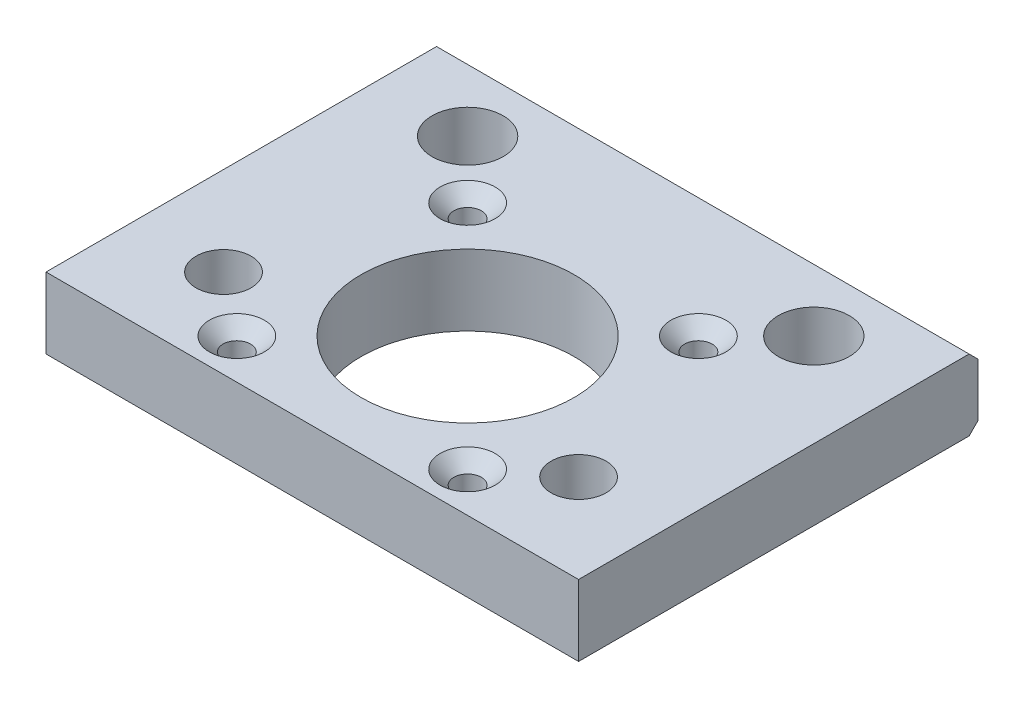
from build123d import *

# Parameters (mm, degrees)
SKETCH_1_W                  = 60
SKETCH_1_H                  = 45
SKETCH_1_R                  = 2.5
SKETCH_1_R_2                = 12
EXTRUDE_1_DEPTH             = 8
CHAMFER_1_SIZE              = 1
SKETCH_2_R                  = 4
CUT_EXTRUDE_1_DEPTH         = 6
SKETCH_3_R                  = 1.25
CUT_EXTRUDE_2_DEPTH         = 39.34383914
HOLE_WIZARD_2_D             = 6.2
HOLE_WIZARD_2_CSINK_D       = 13.2
HOLE_WIZARD_2_CSINK_ANGLE   = 90
HOLE_WIZARD_2_2_D           = 3.1
HOLE_WIZARD_2_2_CSINK_D     = 6.2
HOLE_WIZARD_2_2_CSINK_ANGLE = 90


with BuildPart() as part:
    # 草图1 → 凸台-拉伸1 (new body)
    with BuildSketch(Plane(origin=(0, 0, 0), x_dir=(1, 0, 0), z_dir=(0, 1, 0))):
        Rectangle(SKETCH_1_W, SKETCH_1_H)
        with Locations(Location((-20, -12.5, 0), (0, 0, 270))):
            Circle(SKETCH_1_R, mode=Mode.SUBTRACT)
        with Locations(Location((20, -12.5, 0), (0, 0, 90))):
            Circle(SKETCH_1_R, mode=Mode.SUBTRACT)
        with Locations(Location((0, -5, 0), (0, 0, 270))):
            Circle(SKETCH_1_R_2, mode=Mode.SUBTRACT)
    extrude(amount=EXTRUDE_1_DEPTH)

    # 倒角1
    chamfer_1_edges = [part.edges().sort_by_distance(p)[0] for p in [
        (0, 8, -22.5),
        (0, 0, -22.5),
    ]]
    chamfer(chamfer_1_edges, length=CHAMFER_1_SIZE)

    # 草图2 → 切除-拉伸1 (cut)
    with BuildSketch(Plane(origin=(0, 8, 0), x_dir=(1, 0, 0), z_dir=(0, 1, 0))):
        with Locations(Location((-19.5, 14.5, 0), (0, 0, 270))):
            Circle(SKETCH_2_R)
        with Locations(Location((19.5, 14.5, 0), (0, 0, 90))):
            Circle(SKETCH_2_R)
    extrude(amount=-CUT_EXTRUDE_1_DEPTH, mode=Mode.SUBTRACT)

    # 草图3 → 切除-拉伸2 (cut, through all)
    with BuildSketch(Plane(origin=(0, 0, 0), x_dir=(-1, 0, 0), z_dir=(0, -1, 0))):
        with Locations(Location((13, -18, 0), (0, 0, 90))):
            Circle(SKETCH_3_R)
        with Locations(Location((-13, -18, 0), (0, 0, 270))):
            Circle(SKETCH_3_R)
        with Locations(Location((13, 8, 0), (0, 0, 90))):
            Circle(SKETCH_3_R)
        with Locations(Location((-13, 8, 0), (0, 0, 270))):
            Circle(SKETCH_3_R)
    extrude(amount=-CUT_EXTRUDE_2_DEPTH, mode=Mode.SUBTRACT)

    # Hole Wizard 2 (through all)
    with Locations(Plane(origin=(20, 0, 12.5), x_dir=(0, 0, -1), z_dir=(0, -1, 0))):
        with Locations((0, 0), (0, -40)):
            CounterSinkHole(HOLE_WIZARD_2_D / 2, HOLE_WIZARD_2_CSINK_D / 2, counter_sink_angle=HOLE_WIZARD_2_CSINK_ANGLE)

    # Hole Wizard 2 2 (through all)
    with Locations(Plane(origin=(-13, 8, -8), x_dir=(0, 0, 1), z_dir=(0, 1, 0))):
        with Locations((0, 0), (26, 0), (26, 26), (0, 26)):
            CounterSinkHole(HOLE_WIZARD_2_2_D / 2, HOLE_WIZARD_2_2_CSINK_D / 2, counter_sink_angle=HOLE_WIZARD_2_2_CSINK_ANGLE)


solid = part.part
